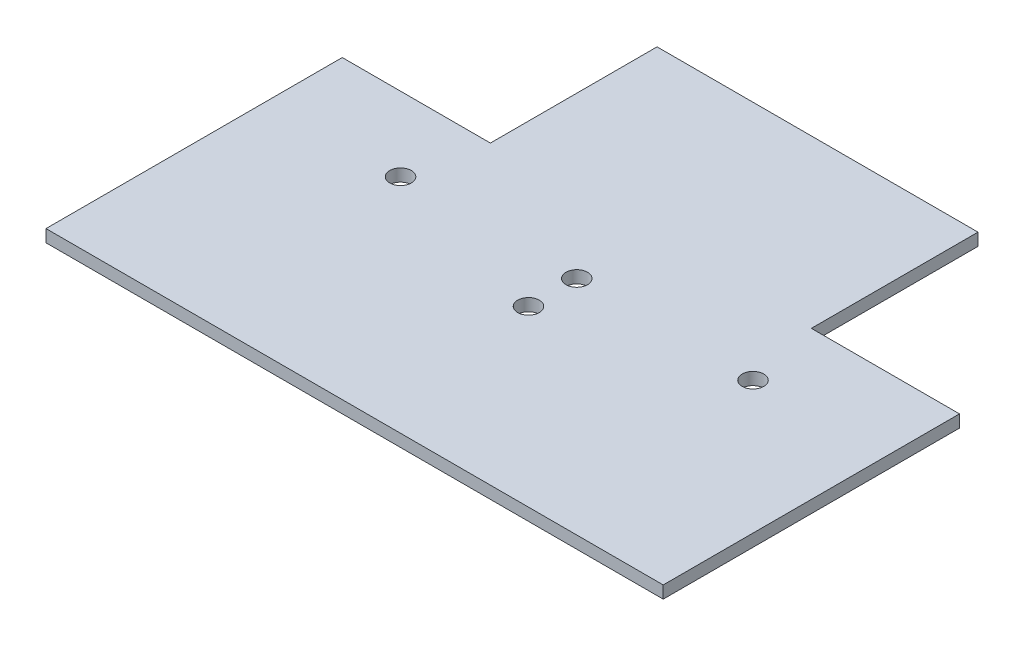
from build123d import *

# Parameters (mm, degrees)
CROQUIS1_R              = 1.75
SALIENTE_EXTRUIR1_DEPTH = 2


with BuildPart() as part:
    # Croquis1 → Saliente-Extruir1 (new body)
    with BuildSketch(Plane(origin=(0, 0, 0), x_dir=(1, 0, 0), z_dir=(0, 1, 0))):
        Polygon((-26, 10.5), (-50, 10.5), (-50, -37.5), (50, -37.5), (50, 10.5), (26, 10.5), (26, 37.5), (-26, 37.5), align=None)
        with Locations(Location((-28.55, -1.504051409, 0), (0, 0, 270))):
            Circle(CROQUIS1_R, mode=Mode.SUBTRACT)
        with Locations(Location((0, -9.329285485, 0), (0, 0, 270))):
            Circle(CROQUIS1_R, mode=Mode.SUBTRACT)
        with Locations(Location((0, -1.504051409, 0), (0, 0, 270))):
            Circle(CROQUIS1_R, mode=Mode.SUBTRACT)
        with Locations(Location((28.55, -1.504051409, 0), (0, 0, 270))):
            Circle(CROQUIS1_R, mode=Mode.SUBTRACT)
    extrude(amount=SALIENTE_EXTRUIR1_DEPTH)


solid = part.part
